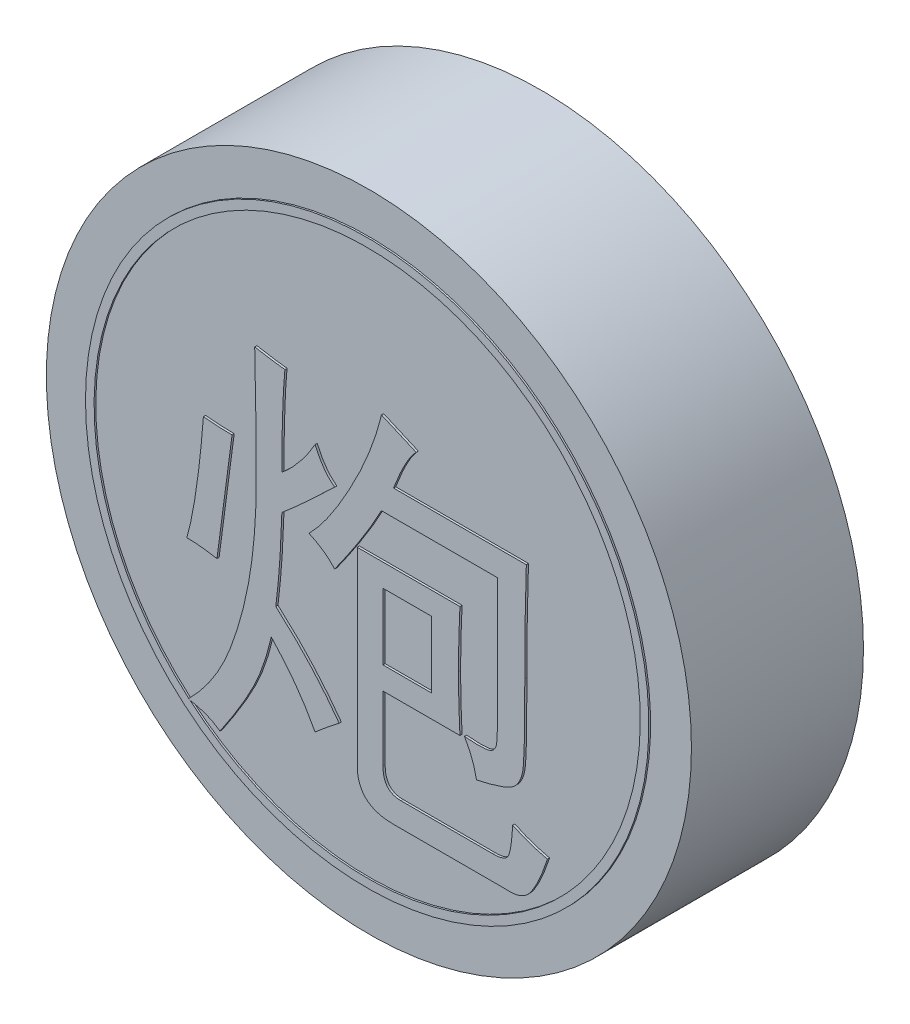
from build123d import *

# Parameters (mm, degrees)
SKETCH_1_R               = 15
DIAMETER30_HEIGHT8_DEPTH = 8
SKETCH_2_W               = 2.245614035
SKETCH_2_H               = 3.087719298
CHARACTER_DEPTH          = 0.1
SKETCH_3_R               = 13.1
SKETCH_3_R_2             = 12.7
INK_RING_DEPTH           = 0.08


with BuildPart() as part:
    # 草图1 → Diameter30_Height8 (new body)
    with BuildSketch(Plane.XY):
        Circle(SKETCH_1_R)
    extrude(amount=-DIAMETER30_HEIGHT8_DEPTH)

    # 草图2 → Character_炮 (add)
    # profile 1 of 4: a face of its own
    with BuildSketch(Plane.XY):
        with BuildLine():
            Line((-0.438596491, 0.412280702), (4.333333333, 0.412280702))
            add(Edge.make_bspline(
                [(4.333333333, 0.412280702), (4.32219403, 0.180991034), (4.300254935, -0.274538914), (4.280545765, -0.95042467), (4.266792277, -1.608022946), (4.264356298, -2.041253788), (4.263157895, -2.254385965)],
                knots=[0, 0, 0, 0, 1.041529255, 2.051314145, 3.04132481, 4, 4, 4, 4], degree=3))
            add(Edge.make_bspline(
                [(4.263157895, -2.254385965), (4.264340978, -2.456256151), (4.266737832, -2.865232575), (4.280700455, -3.488172277), (4.300139267, -4.128551913), (4.322178287, -4.561543263), (4.333333333, -4.780701754)],
                knots=[0, 0, 0, 0, 0.958414871, 1.941688842, 2.958186192, 4, 4, 4, 4], degree=3))
            Line((4.333333333, -4.780701754), (0.754385965, -4.780701754))
            Line((0.754385965, -4.780701754), (0.754385965, -7.798245614))
            add(Edge.make_bspline(
                [(0.754385965, -7.798245614), (0.756542025, -7.875517819), (0.760571778, -8.019942316), (0.79867763, -8.222584654), (0.866301083, -8.393546444), (0.958730485, -8.537425476), (1.080316095, -8.648955096), (1.230323038, -8.725821375), (1.404766808, -8.773219428), (1.530318809, -8.778119279), (1.596491228, -8.780701754)],
                knots=[0, 0, 0, 0, 1.252760199, 2.341453324, 3.325319473, 4.217929197, 5.093335219, 5.967160472, 6.92858809, 8, 8, 8, 8], degree=3))
            Line((1.596491228, -8.780701754), (5.877192982, -8.780701754))
            add(Edge.make_bspline(
                [(5.877192982, -8.780701754), (5.952676442, -8.778505643), (6.091865118, -8.774456097), (6.282983042, -8.738694541), (6.432873953, -8.670057218), (6.535011145, -8.590100361), (6.590568401, -8.495587019), (6.627825926, -8.39523744), (6.663290389, -8.264597524), (6.696736899, -8.104116088), (6.724132709, -7.913000321), (6.749792718, -7.691981988), (6.773714936, -7.439888276), (6.7840244, -7.261145122), (6.789473684, -7.166666667)],
                knots=[0, 0, 0, 0, 1.261361218, 2.325902893, 3.219579981, 3.999862689, 4.441750613, 5.033083926, 5.784644729, 6.701580166, 7.770148816, 9.008968199, 10.419027196, 12, 12, 12, 12], degree=3))
            add(Edge.make_bspline(
                [(6.789473684, -7.166666667), (6.910015047, -7.223861616), (7.156211115, -7.340677714), (7.549073328, -7.486623437), (7.965883604, -7.620225519), (8.255749653, -7.691657664), (8.403508772, -7.728070175)],
                knots=[0, 0, 0, 0, 0.93451649, 1.908675008, 2.933947809, 4, 4, 4, 4], degree=3))
            add(Edge.make_bspline(
                [(8.403508772, -7.728070175), (8.36949527, -7.8296605), (8.304058566, -8.02510453), (8.198937234, -8.304643175), (8.096064707, -8.560417297), (7.994786169, -8.791899572), (7.89604981, -9.000063782), (7.795682505, -9.182852475), (7.696450007, -9.34228243), (7.600201862, -9.48077287), (7.497384712, -9.598754284), (7.381771504, -9.696234518), (7.252832947, -9.773671097), (7.11391136, -9.837679917), (6.961465129, -9.881457369), (6.797357236, -9.906967442), (6.621323268, -9.914310156), (6.5009461, -9.907194395), (6.438596491, -9.903508772)],
                knots=[0, 0, 0, 0, 1.59358626, 3.065812832, 4.441936642, 5.694264479, 6.824081133, 7.868089909, 8.794324934, 9.616838825, 10.374605891, 11.115526659, 11.855998927, 12.605833349, 13.384785664, 14.20689557, 15.071257761, 16, 16, 16, 16], degree=3))
            Line((6.438596491, -9.903508772), (1.245614035, -9.903508772))
            add(Edge.make_bspline(
                [(1.245614035, -9.903508772), (1.118729026, -9.900633054), (0.879350959, -9.895207796), (0.544624652, -9.825850562), (0.255101887, -9.719457547), (0.014016726, -9.562552167), (-0.1791111, -9.360389951), (-0.317167852, -9.111164898), (-0.411189016, -8.820725067), (-0.429127218, -8.610810398), (-0.438596491, -8.5)],
                knots=[0, 0, 0, 0, 1.225516294, 2.31202822, 3.291071766, 4.193033827, 5.070480065, 5.96763954, 6.927151342, 8, 8, 8, 8], degree=3))
            Line((-0.438596491, -8.5), (-0.438596491, 0.412280702))
        make_face()
        with Locations((1.877192982, -2.184210526)):
            Rectangle(SKETCH_2_W, SKETCH_2_H, mode=Mode.SUBTRACT)
    # profile 2 of 4: a face of its own
    with BuildSketch(Plane.XY):
        with BuildLine():
            add(Edge.make_bspline(
                [(-2.684210526, -0.149122807), (-2.607244312, -0.068348187), (-2.447615588, 0.099179209), (-2.21396229, 0.373003608), (-1.976662273, 0.677888972), (-1.740262061, 1.015456733), (-1.496502959, 1.381351566), (-1.25047895, 1.778427942), (-1.001886572, 2.207139891), (-0.669003024, 2.811251328), (-0.279105655, 3.577593039), (0.117693311, 4.500779683), (0.447568877, 5.404475152), (0.606392816, 6.01022371), (0.684210526, 6.307017544)],
                knots=[0, 0, 0, 0, 0.546400256, 1.133239775, 1.762215174, 2.43802967, 3.15124418, 3.915465038, 4.725518671, 5.57828231, 7.293836538, 8.934212293, 10.497880223, 12, 12, 12, 12], degree=3))
            add(Edge.make_bspline(
                [(0.684210526, 6.307017544), (0.947152723, 6.18906458), (1.482461117, 5.94893115), (2.023144572, 5.721155803), (2.298245614, 5.605263158)],
                knots=[0, 0, 0, 0, 0.982395191, 2, 2, 2, 2], degree=3))
            add(Edge.make_bspline(
                [(2.298245614, 5.605263158), (2.255609317, 5.560222478), (2.164793229, 5.464285009), (2.042158849, 5.291394232), (1.912161769, 5.092979346), (1.781901862, 4.861646679), (1.651209689, 4.599719254), (1.514938612, 4.308440709), (1.381167425, 3.98465958), (1.292053844, 3.758309052), (1.245614035, 3.640350877)],
                knots=[0, 0, 0, 0, 0.663045856, 1.41229974, 2.263621425, 3.202134772, 4.251301671, 5.396319134, 6.643142355, 8, 8, 8, 8], degree=3))
            Line((1.245614035, 3.640350877), (7.421052632, 3.640350877))
            add(Edge.make_bspline(
                [(7.421052632, 3.640350877), (7.415876542, 3.488737431), (7.405110744, 3.173395178), (7.387896511, 2.682247334), (7.379737007, 2.155395839), (7.368115328, 1.594031729), (7.360518712, 0.997957252), (7.356408994, 0.366362277), (7.349378547, -0.300723767), (7.350369501, -0.757307943), (7.350877193, -0.99122807)],
                knots=[0, 0, 0, 0, 0.785958954, 1.634723531, 2.546077398, 3.515771858, 4.543739525, 5.634495728, 6.788089711, 8, 8, 8, 8], degree=3))
            add(Edge.make_bspline(
                [(7.350877193, -0.99122807), (7.351424886, -1.219950248), (7.352464276, -1.654009873), (7.345521867, -2.271714228), (7.341378496, -2.821004426), (7.33420145, -3.302742426), (7.322371891, -3.715929733), (7.315071359, -4.060968483), (7.29756022, -4.338068723), (7.280860397, -4.610606831), (7.237056435, -4.886898815), (7.145088227, -5.171911876), (7.008842414, -5.408615837), (6.857359521, -5.570077576), (6.705782828, -5.673210663), (6.565047823, -5.751034402), (6.393887751, -5.825468616), (6.193851241, -5.90115993), (5.963012143, -5.971642882), (5.704111538, -6.045155197), (5.415740714, -6.118273014), (5.211990817, -6.161544294), (5.105263158, -6.184210526)],
                knots=[0, 0, 0, 0, 2.093243972, 3.972473083, 5.653486224, 7.120535649, 8.381638283, 9.436666045, 10.278480565, 10.922485454, 11.93531434, 12.830443783, 13.647741699, 14.416032427, 14.831754699, 15.321556192, 15.885906174, 16.538300622, 17.278076745, 18.093834768, 19.001518255, 20, 20, 20, 20], degree=3))
            add(Edge.make_bspline(
                [(5.105263158, -6.184210526), (5.078216399, -6.056228209), (5.024186518, -5.800564701), (4.899318544, -5.426672951), (4.741288892, -5.061098719), (4.610094194, -4.82813809), (4.543859649, -4.710526316)],
                knots=[0, 0, 0, 0, 0.989663112, 1.976997679, 2.978673384, 4, 4, 4, 4], degree=3))
            add(Edge.make_bspline(
                [(4.543859649, -4.710526316), (4.653806836, -4.720420658), (4.86131355, -4.739094556), (5.152924836, -4.746823134), (5.405672395, -4.739686335), (5.620537146, -4.71990692), (5.804708808, -4.661399495), (5.941922153, -4.53663161), (6.025729221, -4.358559853), (6.052094978, -4.17615843), (6.05940974, -3.998418574), (6.067697643, -3.825993092), (6.075711226, -3.621566765), (6.080676164, -3.384144914), (6.082516701, -3.113818373), (6.085168767, -2.809726014), (6.088456449, -2.472715567), (6.087972135, -2.237059616), (6.087719298, -2.114035088)],
                knots=[0, 0, 0, 0, 1.363132991, 2.572682894, 3.600404617, 4.484322373, 5.235778938, 5.94045101, 6.706095796, 7.619131718, 8.197834119, 8.90477724, 9.750703209, 10.724657567, 11.837530972, 13.089501406, 14.480570013, 16, 16, 16, 16], degree=3))
            Line((6.087719298, -2.114035088), (6.087719298, 2.447368421))
            Line((6.087719298, 2.447368421), (0.684210526, 2.447368421))
            add(Edge.make_bspline(
                [(0.684210526, 2.447368421), (0.617441899, 2.321297964), (0.480556448, 2.062835086), (0.253981586, 1.673347978), (0.014715029, 1.264967833), (-0.250580666, 0.844350635), (-0.52913706, 0.404851477), (-0.832037599, -0.047442621), (-1.154213023, -0.51480816), (-1.377401323, -0.830317366), (-1.49122807, -0.99122807)],
                knots=[0, 0, 0, 0, 0.84073928, 1.723638498, 2.655419099, 3.63023716, 4.65436133, 5.722196596, 6.838312978, 8, 8, 8, 8], degree=3))
            add(Edge.make_bspline(
                [(-1.49122807, -0.99122807), (-1.566343917, -0.910276075), (-1.722102624, -0.742415646), (-2.003289621, -0.524505592), (-2.325910913, -0.322393255), (-2.561691535, -0.208371882), (-2.684210526, -0.149122807)],
                knots=[0, 0, 0, 0, 0.899510514, 1.865206902, 2.890694684, 4, 4, 4, 4], degree=3))
        make_face()
    # profile 3 of 4: a face of its own
    with BuildSketch(Plane.XY):
        with BuildLine():
            add(Edge.make_bspline(
                [(-8.298245614, -9.622807018), (-8.201263048, -9.522204954), (-8.008394753, -9.322138599), (-7.734940037, -9.009978), (-7.479914369, -8.687288297), (-7.242878701, -8.354300999), (-7.024606013, -8.010061232), (-6.822013667, -7.657383687), (-6.636355534, -7.295200516), (-6.413642512, -6.792856233), (-6.163605748, -6.135128614), (-5.901463294, -5.306022697), (-5.673248955, -4.429872143), (-5.480712448, -3.503655797), (-5.326224679, -2.522896188), (-5.220414285, -1.48170751), (-5.14998176, -0.379682326), (-5.143615389, 0.375777463), (-5.140350877, 0.763157895)],
                knots=[0, 0, 0, 0, 0.602569032, 1.198323232, 1.788840836, 2.375623389, 2.960201216, 3.545971817, 4.129139034, 4.714492441, 5.914900985, 7.161517809, 8.462856384, 9.817737407, 11.239759603, 12.742477888, 14.329626092, 16, 16, 16, 16], degree=3))
            add(Edge.make_bspline(
                [(-5.140350877, 0.763157895), (-5.141563897, 1.17295122), (-5.144056667, 2.015081344), (-5.158055547, 3.313770546), (-5.177687899, 4.681815462), (-5.199405465, 5.617406085), (-5.210526316, 6.096491228)],
                knots=[0, 0, 0, 0, 0.921936609, 1.894590625, 2.921889202, 4, 4, 4, 4], degree=3))
            add(Edge.make_bspline(
                [(-5.210526316, 6.096491228), (-5.084971362, 6.074420647), (-4.839330424, 6.031240844), (-4.479601128, 5.975103703), (-4.137722159, 5.923713282), (-3.915394745, 5.898335658), (-3.807017544, 5.885964912)],
                knots=[0, 0, 0, 0, 1.077673639, 2.108405575, 3.077910785, 4, 4, 4, 4], degree=3))
            add(Edge.make_bspline(
                [(-3.807017544, 5.885964912), (-3.818839372, 5.756921542), (-3.843731891, 5.485202604), (-3.87117703, 5.057051788), (-3.8945594, 4.590035768), (-3.9120307, 4.08311975), (-3.927157054, 3.537294876), (-3.941755979, 2.951664283), (-3.94499699, 2.326945542), (-3.946561132, 1.897226277), (-3.947368421, 1.675438596)],
                knots=[0, 0, 0, 0, 0.737944263, 1.553845279, 2.443057176, 3.400857167, 4.442331426, 5.552733575, 6.736911306, 8, 8, 8, 8], degree=3))
            add(Edge.make_bspline(
                [(-3.947368421, 1.675438596), (-3.798037625, 1.808527791), (-3.497852886, 2.076063666), (-3.097532911, 2.534141521), (-2.722544889, 3.027833407), (-2.510884254, 3.387643638), (-2.403508772, 3.570175439)],
                knots=[0, 0, 0, 0, 0.976260685, 1.962479047, 2.966365221, 4, 4, 4, 4], degree=3))
            add(Edge.make_bspline(
                [(-2.403508772, 3.570175439), (-2.343353726, 3.436861804), (-2.228064192, 3.18136093), (-2.011459923, 2.836759352), (-1.772615912, 2.539643501), (-1.583208762, 2.383058841), (-1.49122807, 2.307017544)],
                knots=[0, 0, 0, 0, 1.112664531, 2.132465744, 3.093080206, 4, 4, 4, 4], degree=3))
            add(Edge.make_bspline(
                [(-1.49122807, 2.307017544), (-1.622185943, 2.183272357), (-1.875632764, 1.943784469), (-2.240464786, 1.594583317), (-2.584384567, 1.274895669), (-2.903795613, 0.981832012), (-3.197702025, 0.713399688), (-3.466950405, 0.47130542), (-3.715247534, 0.257992547), (-3.872791281, 0.124564772), (-3.947368421, 0.061403509)],
                knots=[0, 0, 0, 0, 1.299128935, 2.514244397, 3.641324308, 4.684712061, 5.63984292, 6.511381073, 7.295326248, 8, 8, 8, 8], degree=3))
            add(Edge.make_bspline(
                [(-3.947368421, 0.061403509), (-3.96085549, -0.300790054), (-3.987002005, -1.002951508), (-4.045222676, -2.020518963), (-4.125234803, -2.968585477), (-4.194621288, -3.575734804), (-4.228070175, -3.868421053)],
                knots=[0, 0, 0, 0, 1.103554606, 2.13939061, 3.103062858, 4, 4, 4, 4], degree=3))
            add(Edge.make_bspline(
                [(-4.228070175, -3.868421053), (-3.952935381, -4.116436024), (-3.405575654, -4.609842928), (-2.643782001, -5.4032241), (-1.928582474, -6.226565922), (-1.49636276, -6.806917915), (-1.280701754, -7.096491228)],
                knots=[0, 0, 0, 0, 1.014484449, 2.018239572, 3.011177804, 4, 4, 4, 4], degree=3))
            add(Edge.make_bspline(
                [(-1.280701754, -7.096491228), (-1.469173857, -7.241259475), (-1.851750676, -7.535122463), (-2.217793014, -7.849346684), (-2.403508772, -8.00877193)],
                knots=[0, 0, 0, 0, 0.98527717, 2, 2, 2, 2], degree=3))
            add(Edge.make_bspline(
                [(-2.403508772, -8.00877193), (-2.538497471, -7.764008873), (-2.811638587, -7.268746273), (-3.293770693, -6.55785765), (-3.835128902, -5.863335742), (-4.235469285, -5.424442687), (-4.438596491, -5.201754386)],
                knots=[0, 0, 0, 0, 0.964095333, 1.950786066, 2.960257024, 4, 4, 4, 4], degree=3))
            add(Edge.make_bspline(
                [(-4.438596491, -5.201754386), (-4.49920244, -5.452249445), (-4.617494307, -5.941170564), (-4.849661513, -6.641551746), (-5.108325764, -7.297020352), (-5.515736792, -8.101792781), (-6.079066858, -9.067269108), (-6.574665505, -9.809802583), (-6.824561404, -10.184210526)],
                knots=[0, 0, 0, 0, 0.833641504, 1.627117669, 2.385635067, 3.111574229, 4.543567946, 6, 6, 6, 6], degree=3))
            add(Edge.make_bspline(
                [(-6.824561404, -10.184210526), (-6.923292445, -10.117017015), (-7.127669973, -9.977923538), (-7.480094506, -9.823564039), (-7.873238056, -9.699691727), (-8.152811717, -9.649116298), (-8.298245614, -9.622807018)],
                knots=[0, 0, 0, 0, 0.898656135, 1.860257086, 2.886908194, 4, 4, 4, 4], degree=3))
        make_face()
    # profile 4 of 4: a face of its own
    with BuildSketch(Plane.XY):
        with BuildLine():
            add(Edge.make_bspline(
                [(-6.263157895, 2.026315789), (-6.297796695, 1.757741086), (-6.365287402, 1.234446498), (-6.464215053, 0.469468601), (-6.55793518, -0.255658116), (-6.645735983, -0.942003606), (-6.730984508, -1.589254142), (-6.816100576, -2.196945166), (-6.889305096, -2.765806117), (-6.940348773, -3.131187016), (-6.964912281, -3.307017544)],
                knots=[0, 0, 0, 0, 1.208176354, 2.354027158, 3.441385877, 4.470252566, 5.441127555, 6.354025658, 7.207915526, 8, 8, 8, 8], degree=3))
            add(Edge.make_bspline(
                [(-6.964912281, -3.307017544), (-7.090365666, -3.285107458), (-7.334503846, -3.242469403), (-7.694451705, -3.198667195), (-8.037025851, -3.170995275), (-8.260076685, -3.168081836), (-8.368421053, -3.166666667)],
                knots=[0, 0, 0, 0, 1.081815404, 2.105263584, 3.079653667, 4, 4, 4, 4], degree=3))
            add(Edge.make_bspline(
                [(-8.368421053, -3.166666667), (-8.327101644, -3.017149112), (-8.239240029, -2.699214896), (-8.131491073, -2.187371787), (-8.024897509, -1.61804539), (-7.923294159, -0.989881086), (-7.830803244, -0.302518286), (-7.746218702, 0.444626132), (-7.664615975, 1.250260876), (-7.619723884, 1.807900384), (-7.596491228, 2.096491228)],
                knots=[0, 0, 0, 0, 0.698704299, 1.485725231, 2.355362038, 3.308254067, 4.352084769, 5.47966451, 6.695670343, 8, 8, 8, 8], degree=3))
            add(Edge.make_bspline(
                [(-7.596491228, 2.096491228), (-7.498672058, 2.085207538), (-7.294748788, 2.06168447), (-6.973764522, 2.042963685), (-6.627145963, 2.029535847), (-6.387063524, 2.027411933), (-6.263157895, 2.026315789)],
                knots=[0, 0, 0, 0, 0.884317725, 1.843533967, 2.887056125, 4, 4, 4, 4], degree=3))
        make_face()
    extrude(amount=CHARACTER_DEPTH)

    # 草图3 → Ink_ring (add)
    with BuildSketch(Plane.XY):
        with Locations(Location((0, 0, 0), (0, 0, 180))):
            Circle(SKETCH_3_R)
        Circle(SKETCH_3_R_2, mode=Mode.SUBTRACT)
    extrude(amount=INK_RING_DEPTH)


solid = part.part
